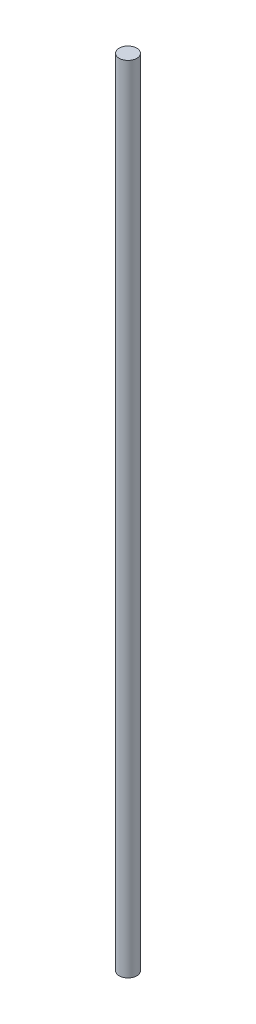
from build123d import *

# Parameters (mm, degrees)
SKETCH_1_R      = 5
EXTRUDE_1_DEPTH = 450


with BuildPart() as part:
    # 草圖1 → 填料-伸長1 (new body)
    with BuildSketch(Plane(origin=(0, 0, 0), x_dir=(1, 0, 0), z_dir=(0, 1, 0))):
        with Locations(Location((0, 0, 0), (0, 0, 270))):
            Circle(SKETCH_1_R)
    extrude(amount=EXTRUDE_1_DEPTH)


solid = part.part
